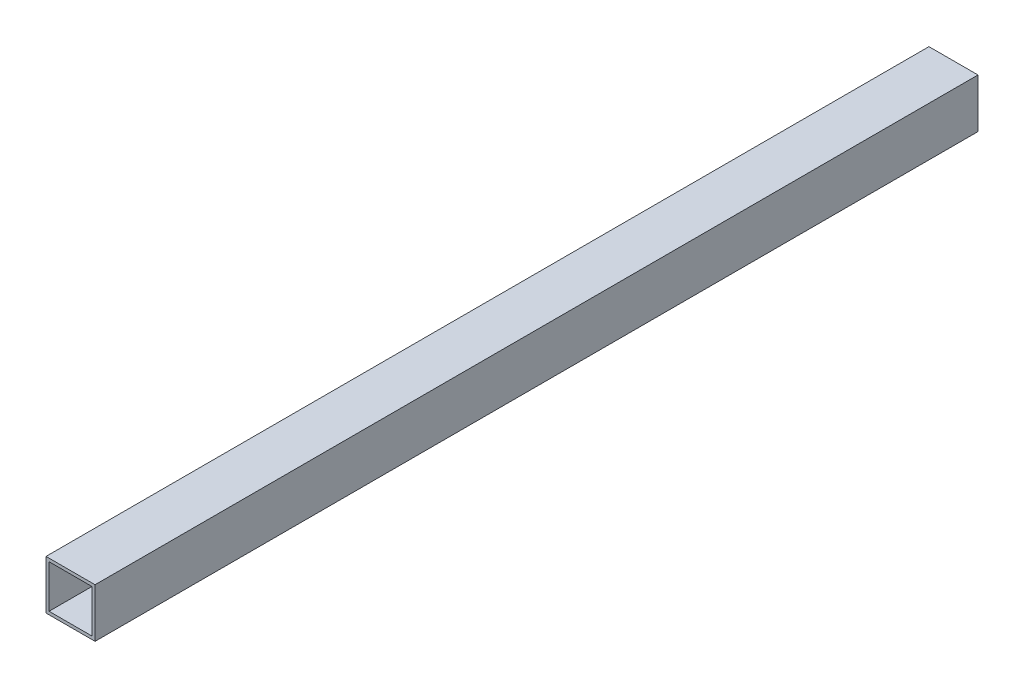
from build123d import *

# Parameters (mm, degrees)
SKETCH1_W           = 25.4
SKETCH1_H           = 457.2
BOSS_EXTRUDE1_DEPTH = 25.4
SKETCH3_W           = 22.225
SKETCH3_H           = 22.225
CUT_EXTRUDE2_DEPTH  = 457.2


with BuildPart() as part:
    # Sketch1 → Boss-Extrude1 (new body)
    with BuildSketch(Plane(origin=(0, 0, 0), x_dir=(1, 0, 0), z_dir=(0, 1, 0))):
        Rectangle(SKETCH1_W, SKETCH1_H)
    extrude(amount=BOSS_EXTRUDE1_DEPTH)

    # Sketch3 → Cut-Extrude2 (cut)
    with BuildSketch(Plane.XY.offset(228.6)):
        with Locations((0, 12.7)):
            Rectangle(SKETCH3_W, SKETCH3_H)
    extrude(amount=-CUT_EXTRUDE2_DEPTH, mode=Mode.SUBTRACT)


solid = part.part
